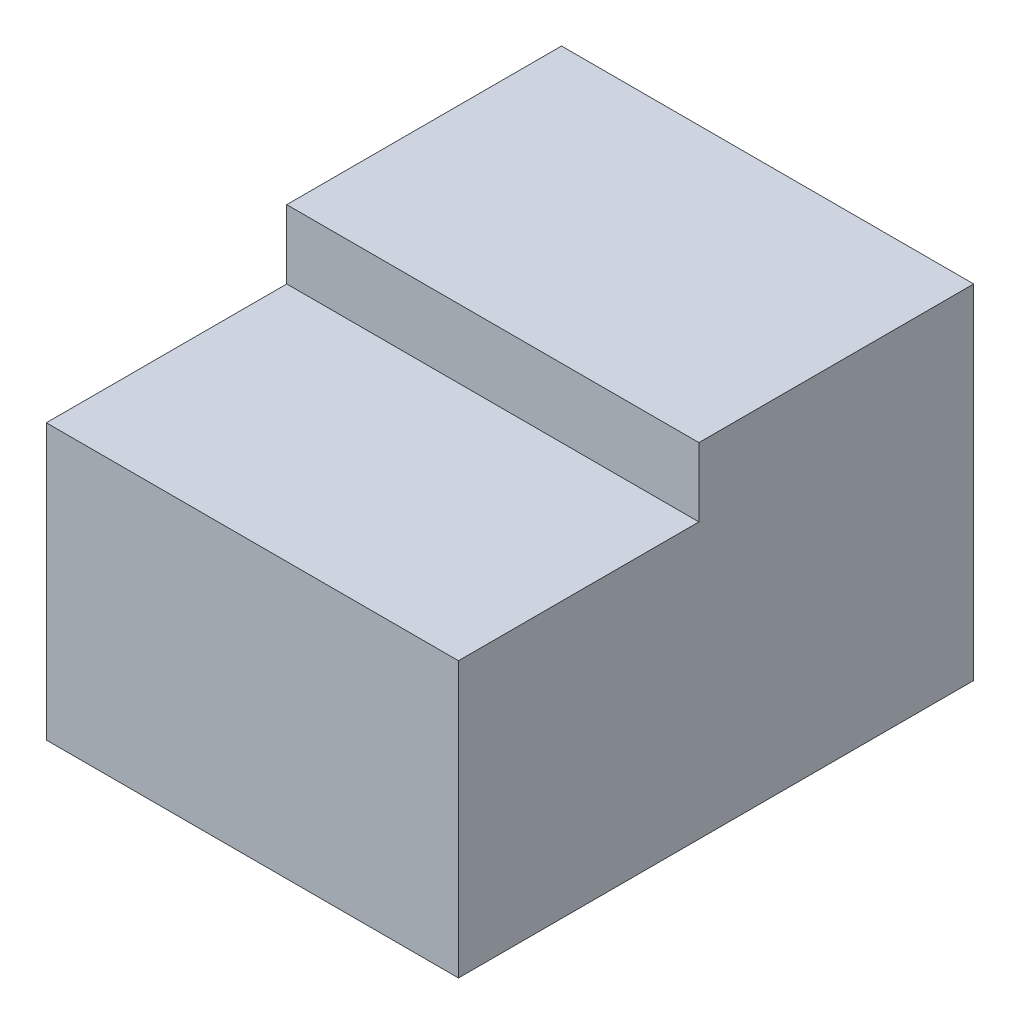
from build123d import *

# Parameters (mm, degrees)
BOSS_EXTRUDE1_DEPTH = 12
CUT_EXTRUDE1_DEPTH  = 5
CUT_EXTRUDE2_DEPTH  = 5


with BuildPart() as part:
    # Sketch2 → Boss-Extrude1 (new body)
    with BuildSketch(Plane(origin=(0, 0, 0), x_dir=(0, 0, -1), z_dir=(1, 0, 0))):
        Polygon((0, 0), (-15, 0), (-15, 8), (-8, 8), (-8, 10), (0, 10), align=None)
    extrude(amount=BOSS_EXTRUDE1_DEPTH)

    # Sketch3 → Cut-Extrude1 (cut)
    with BuildSketch(Plane(origin=(0, 0, 0), x_dir=(-1, 0, 0), z_dir=(0, 0, -1))):
        Polygon((-4.41228676, 7.75), (-7.58771324, 7.75), (-9.175426481, 5), (-7.58771324, 2.25), (-4.41228676, 2.25), (-2.824573519, 5), align=None)
    extrude(amount=-CUT_EXTRUDE1_DEPTH, mode=Mode.SUBTRACT)

    # Sketch4 → Cut-Extrude2 (cut)
    with BuildSketch(Plane.XZ):
        Polygon((4.41228676, 7.25), (7.58771324, 7.25), (9.175426481, 10), (7.58771324, 12.75), (4.41228676, 12.75), (2.824573519, 10), align=None)
    extrude(amount=-CUT_EXTRUDE2_DEPTH, mode=Mode.SUBTRACT)


solid = part.part
